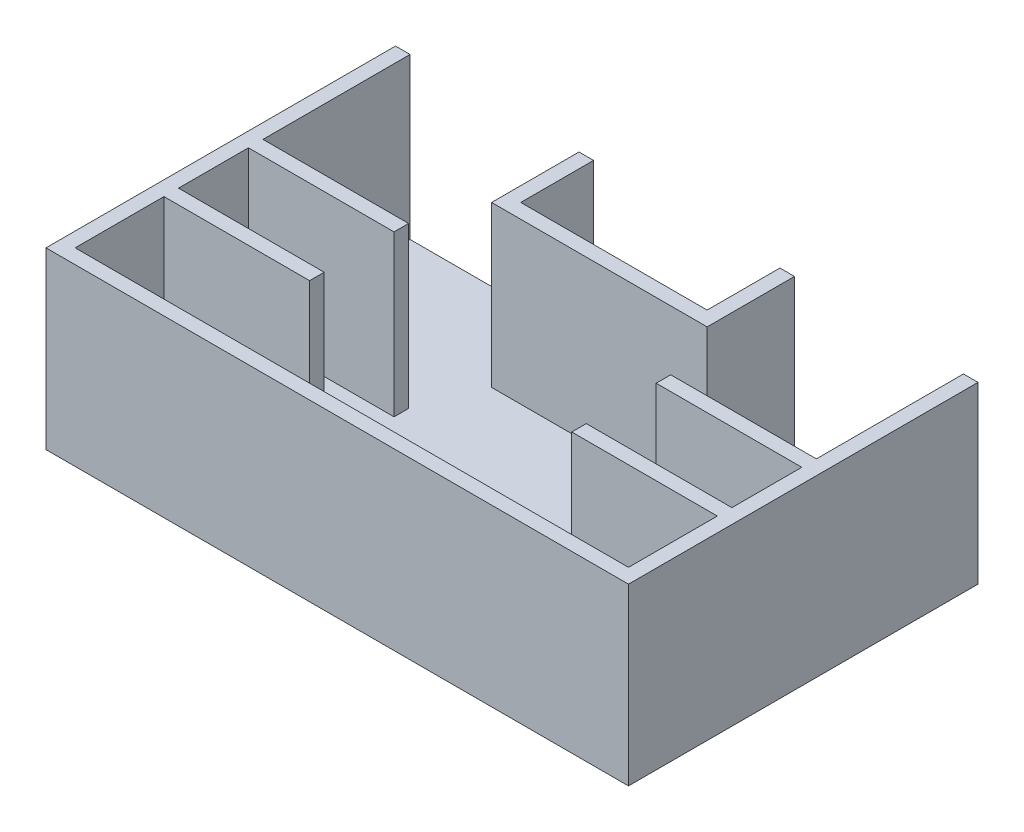
from build123d import *

# Parameters (mm, degrees)
SKETCH2_W           = 100
SKETCH2_H           = 100
BOSS_EXTRUDE1_DEPTH = 2.5
BOSS_EXTRUDE2_DEPTH = 27.5
SKETCH9_W           = 32
SKETCH9_H           = 52.5
CUT_EXTRUDE3_DEPTH  = 2.5
CUT_EXTRUDE4_REACH  = 117.758
SKETCH5_W           = 40
SKETCH5_H           = 30


with BuildPart() as part:
    # Sketch2 → Boss-Extrude1 (new body)
    with BuildSketch(Plane(origin=(0, 0, 0), x_dir=(1, 0, 0), z_dir=(0, 1, 0))):
        Rectangle(SKETCH2_W, SKETCH2_H)
    extrude(amount=BOSS_EXTRUDE1_DEPTH)

    # Sketch4 → Boss-Extrude2 (add)
    with BuildSketch(Plane(origin=(0, 2.5, 0), x_dir=(1, 0, 0), z_dir=(0, 1, 0))):
        Polygon((-50, 50), (-50, -50), (50, -50), (50, 50), (16, 50), (16, 47.5), (16, -2.5), (-16, -2.5), (-16, 47.5), (-16, 50), align=None)
        Polygon((-47.5, -47.5), (47.5, -47.5), (47.5, -32.25), (22.5, -32.25), (22.5, -29.75), (47.5, -29.75), (47.5, -17.75), (22.5, -17.75), (22.5, -15.25), (47.5, -15.25), (47.5, 47.5), (18.5, 47.5), (18.5, -5), (-18.5, -5), (-18.5, 47.5), (-47.5, 47.5), (-47.5, -15.25), (-22.5, -15.25), (-22.5, -17.75), (-47.5, -17.75), (-47.5, -29.75), (-22.5, -29.75), (-22.5, -32.25), (-47.5, -32.25), align=None, mode=Mode.SUBTRACT)
    extrude(amount=BOSS_EXTRUDE2_DEPTH)

    # Sketch9 → Cut-Extrude3 (cut)
    with BuildSketch(Plane(origin=(0, 2.5, 0), x_dir=(1, 0, 0), z_dir=(0, 1, 0))):
        with Locations((0, 23.75)):
            Rectangle(SKETCH9_W, SKETCH9_H)
    extrude(amount=-CUT_EXTRUDE3_DEPTH, mode=Mode.SUBTRACT)

    # Cut-Extrude4: up to this face of the body (flat: up to its plane)
    cut_extrude4_end = Plane(part.part.faces().sort_by_distance((-50, 15, 0))[0])
    # Sketch5 → Cut-Extrude4 (cut, up to the picked face)
    with BuildSketch(Plane(origin=(50, 0, 0), x_dir=(0, 0, -1), z_dir=(1, 0, 0)), mode=Mode.PRIVATE) as cut_extrude4_sk1:
        with Locations((30, 15)):
            Rectangle(SKETCH5_W, SKETCH5_H)
    cut_extrude4_tool1 = split(extrude(cut_extrude4_sk1.sketch, amount=-CUT_EXTRUDE4_REACH, mode=Mode.PRIVATE), bisect_by=cut_extrude4_end, keep=Keep.BOTH, mode=Mode.PRIVATE)
    add(cut_extrude4_tool1.solids().sort_by(Axis((50, 15, -30), (-1, 0, 0)))[0], mode=Mode.SUBTRACT)


solid = part.part
